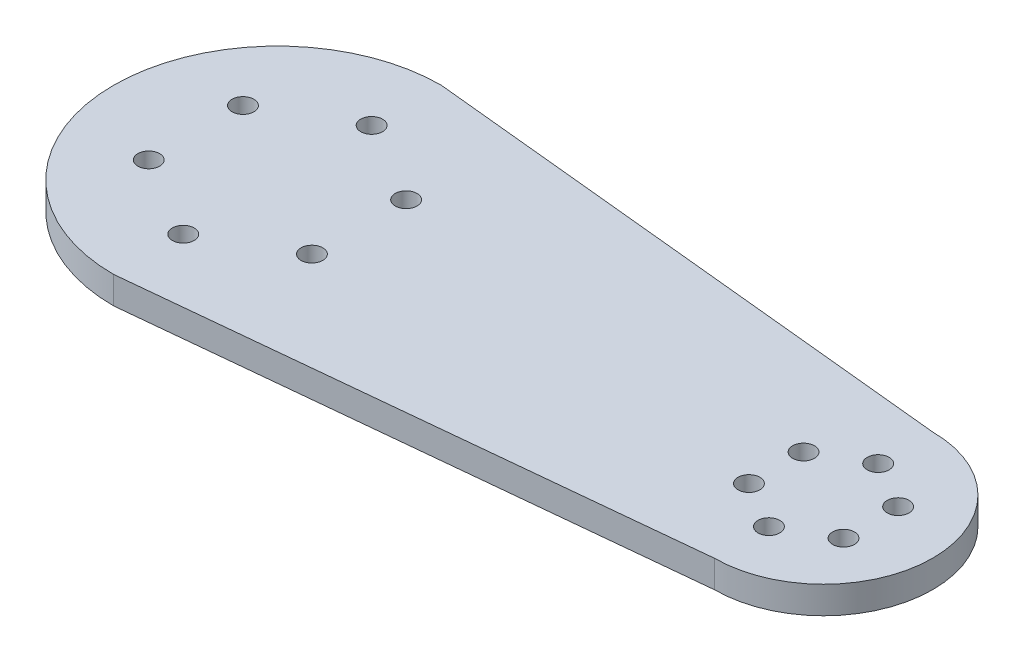
from build123d import *

# Parameters (mm, degrees)
SKETCH_1_R      = 2
EXTRUDE_1_DEPTH = 5


with BuildPart() as part:
    # 草图1 → 凸台-拉伸1 (new body)
    with BuildSketch(Plane(origin=(0, 0, 0), x_dir=(1, 0, 0), z_dir=(0, 1, 0))):
        with BuildLine():
            Line((0, -30), (100, -20))
            ThreePointArc((100, -20), (120, 0), (100, 20))
            Line((100, 20), (0, 30))
            ThreePointArc((0, 30), (-30, 0), (0, -30))
        make_face()
        with Locations(Location((0, -17.25, 0), (0, 0, 270))):
            Circle(SKETCH_1_R, mode=Mode.SUBTRACT)
        with Locations(Location((-14.938938215, -8.625, 0), (0, 0, 270))):
            Circle(SKETCH_1_R, mode=Mode.SUBTRACT)
        with Locations(Location((14.938938215, -8.625, 0), (0, 0, 270))):
            Circle(SKETCH_1_R, mode=Mode.SUBTRACT)
        with Locations(Location((-14.938938215, 8.625, 0), (0, 0, 270))):
            Circle(SKETCH_1_R, mode=Mode.SUBTRACT)
        with Locations(Location((14.938938215, 8.625, 0), (0, 0, 270))):
            Circle(SKETCH_1_R, mode=Mode.SUBTRACT)
        with Locations(Location((0, 17.25, 0), (0, 0, 270))):
            Circle(SKETCH_1_R, mode=Mode.SUBTRACT)
        with Locations(Location((91.339745962, -5, 0), (0, 0, 270))):
            Circle(SKETCH_1_R, mode=Mode.SUBTRACT)
        with Locations(Location((100, -10, 0), (0, 0, 270))):
            Circle(SKETCH_1_R, mode=Mode.SUBTRACT)
        with Locations(Location((108.660254038, -5, 0), (0, 0, 270))):
            Circle(SKETCH_1_R, mode=Mode.SUBTRACT)
        with Locations(Location((108.660254038, 5, 0), (0, 0, 270))):
            Circle(SKETCH_1_R, mode=Mode.SUBTRACT)
        with Locations(Location((100, 10, 0), (0, 0, 270))):
            Circle(SKETCH_1_R, mode=Mode.SUBTRACT)
        with Locations(Location((91.339745962, 5, 0), (0, 0, 270))):
            Circle(SKETCH_1_R, mode=Mode.SUBTRACT)
    extrude(amount=EXTRUDE_1_DEPTH)


solid = part.part
